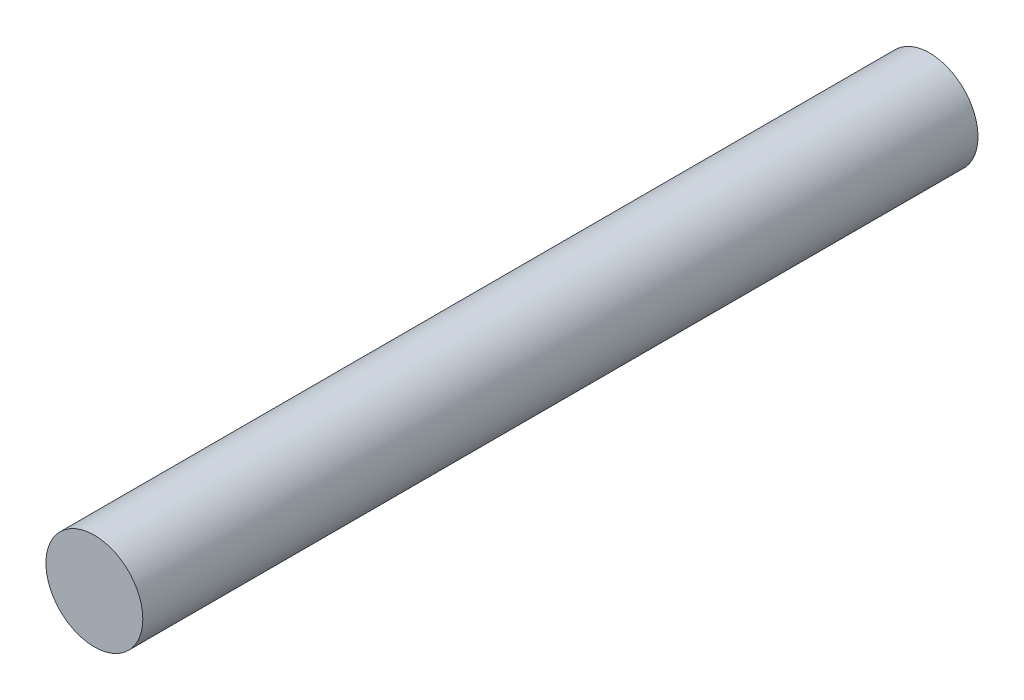
from build123d import *

# Parameters (mm, degrees)
SKETCH1_R           = 4.7879
BOSS_EXTRUDE1_DEPTH = 82.55


with BuildPart() as part:
    # Sketch1 → Boss-Extrude1 (new body)
    with BuildSketch(Plane.XY):
        Circle(SKETCH1_R)
    extrude(amount=BOSS_EXTRUDE1_DEPTH)


solid = part.part
